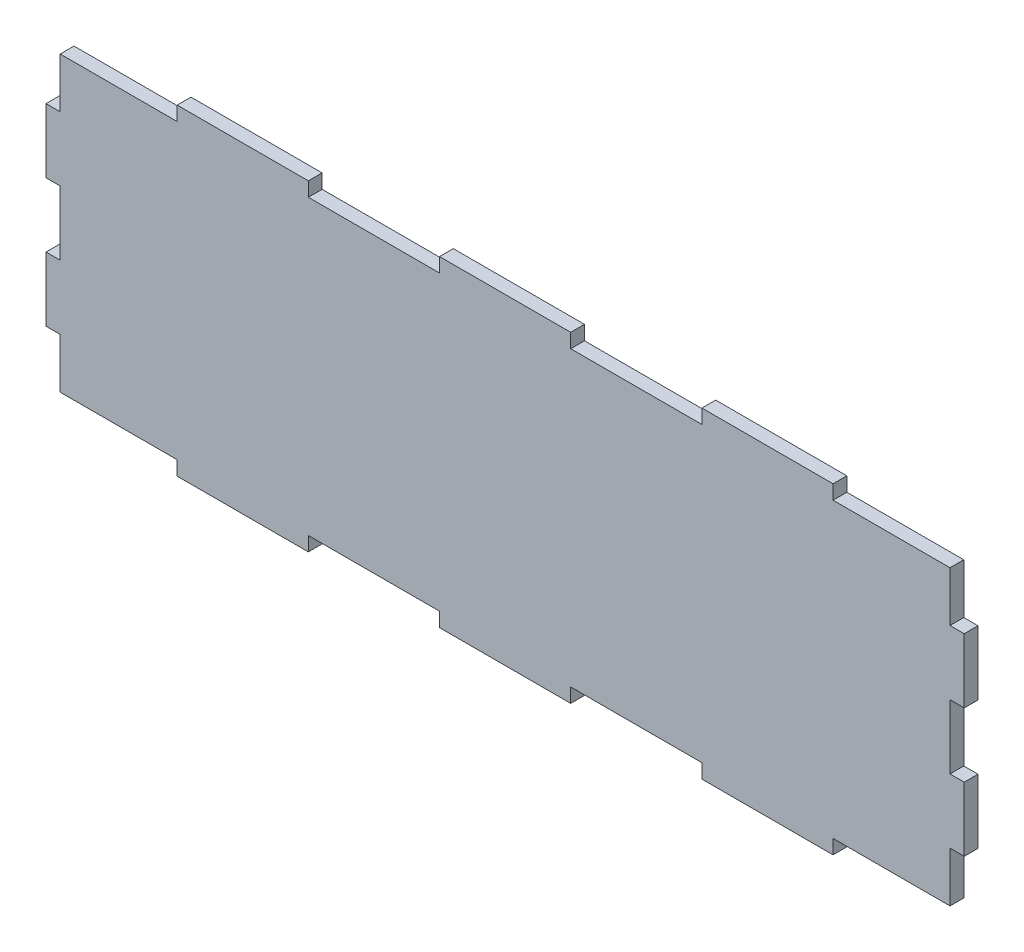
from build123d import *

# Parameters (mm, degrees)
SALIENTE_EXTRUIR2_DEPTH = 3


with BuildPart() as part:
    # Croquis1 → Saliente-Extruir2 (new body)
    with BuildSketch(Plane.XY):
        Polygon((-71.428571429, -31.9), (-71.428571429, -35), (-42.857142857, -35), (-42.857142857, -31.9), (-14.285714286, -31.9), (-14.285714286, -35), (14.285714286, -35), (14.285714286, -31.9), (42.857142857, -31.9), (42.857142857, -35), (71.428571429, -35), (71.428571429, -31.9), (96.9, -31.9), (96.9, -21), (100, -21), (100, -7), (96.9, -7), (96.9, 7), (100, 7), (100, 21), (96.9, 21), (96.9, 31.9), (71.428571429, 31.9), (71.428571429, 35), (42.857142857, 35), (42.857142857, 31.9), (14.285714286, 31.9), (14.285714286, 35), (-14.285714286, 35), (-14.285714286, 31.9), (-42.857142857, 31.9), (-42.857142857, 35), (-71.428571429, 35), (-71.428571429, 31.9), (-96.9, 31.9), (-96.9, 21), (-100, 21), (-100, 7), (-96.9, 7), (-96.9, -7), (-100, -7), (-100, -21), (-96.9, -21), (-96.9, -31.9), align=None)
    extrude(amount=SALIENTE_EXTRUIR2_DEPTH)


solid = part.part
